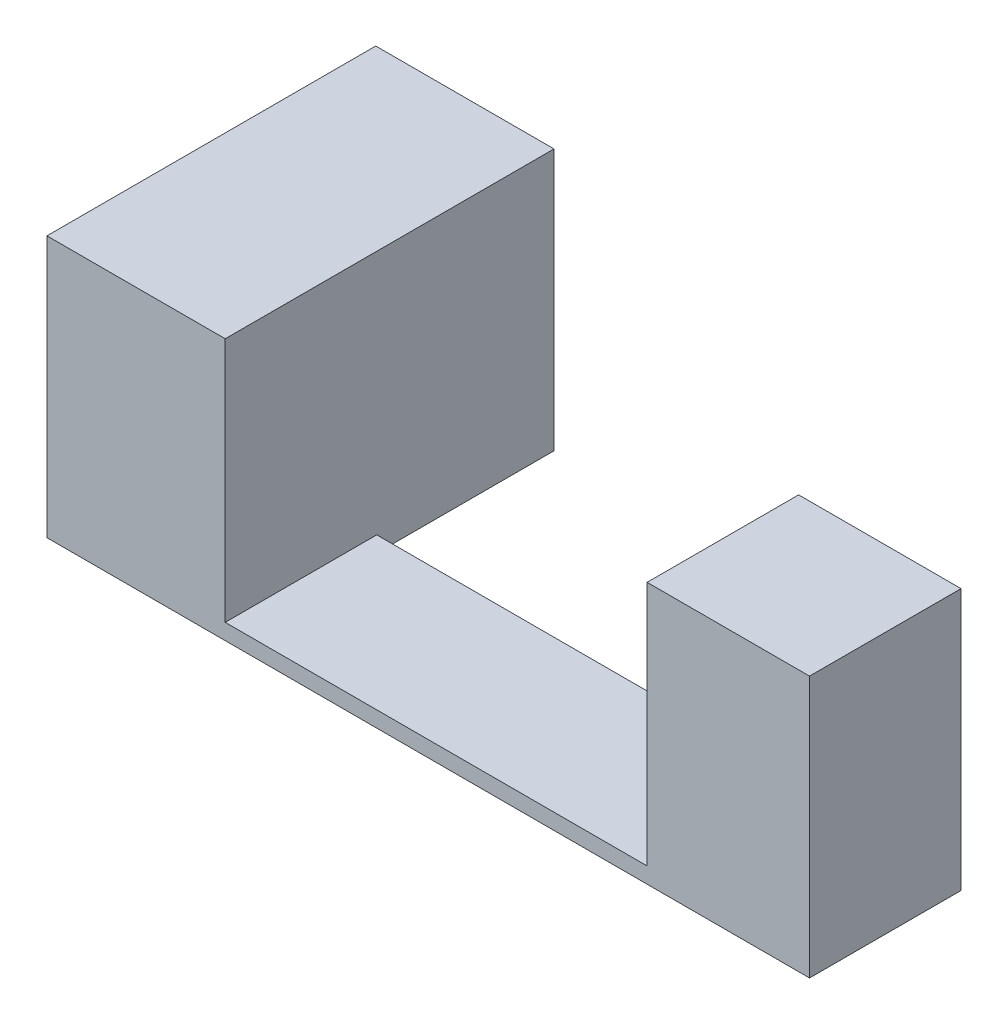
from build123d import *

# Parameters (mm, degrees)
SCHIZZO1_W                   = 4.5
SCHIZZO1_H                   = 3.825
SCHIZZO1_H_2                 = 4.475
SCHIZZO1_W_2                 = 4.1
ESTRUSIONE_ESTRUSIONE1_DEPTH = 6.6
SCHIZZO1_4_W                 = 4.5
SCHIZZO1_4_H                 = 4.475
SCHIZZO1_4_H_2               = 3.825
SCHIZZO1_4_W_2               = 10.65
SCHIZZO1_4_W_3               = 4.1
ESTRUSIONE_ESTRUSIONE2_DEPTH = 0.4


with BuildPart() as part:
    # Schizzo1 → Estrusione-Estrusione1 (new body)
    with BuildSketch(Plane.XZ.offset(-9.997150898)):
        with Locations((-38.335959006, 140.797368204)):
            Rectangle(SCHIZZO1_W, SCHIZZO1_H)
        with Locations((-38.335959006, 136.647368204)):
            Rectangle(SCHIZZO1_W, SCHIZZO1_H_2)
        with Locations((-23.385959006, 140.797368204)):
            Rectangle(SCHIZZO1_W_2, SCHIZZO1_H)
    extrude(amount=-ESTRUSIONE_ESTRUSIONE1_DEPTH)

    # Schizzo1<4> → Estrusione-Estrusione2 (add)
    with BuildSketch(Plane.XZ.offset(-9.997150898)):
        with Locations((-38.335959006, 136.647368204)):
            Rectangle(SCHIZZO1_4_W, SCHIZZO1_4_H)
        with Locations((-38.335959006, 140.797368204)):
            Rectangle(SCHIZZO1_4_W, SCHIZZO1_4_H_2)
        with Locations((-30.760959006, 140.797368204)):
            Rectangle(SCHIZZO1_4_W_2, SCHIZZO1_4_H_2)
        with Locations((-23.385959006, 140.797368204)):
            Rectangle(SCHIZZO1_4_W_3, SCHIZZO1_4_H_2)
    extrude(amount=-ESTRUSIONE_ESTRUSIONE2_DEPTH)


solid = part.part
